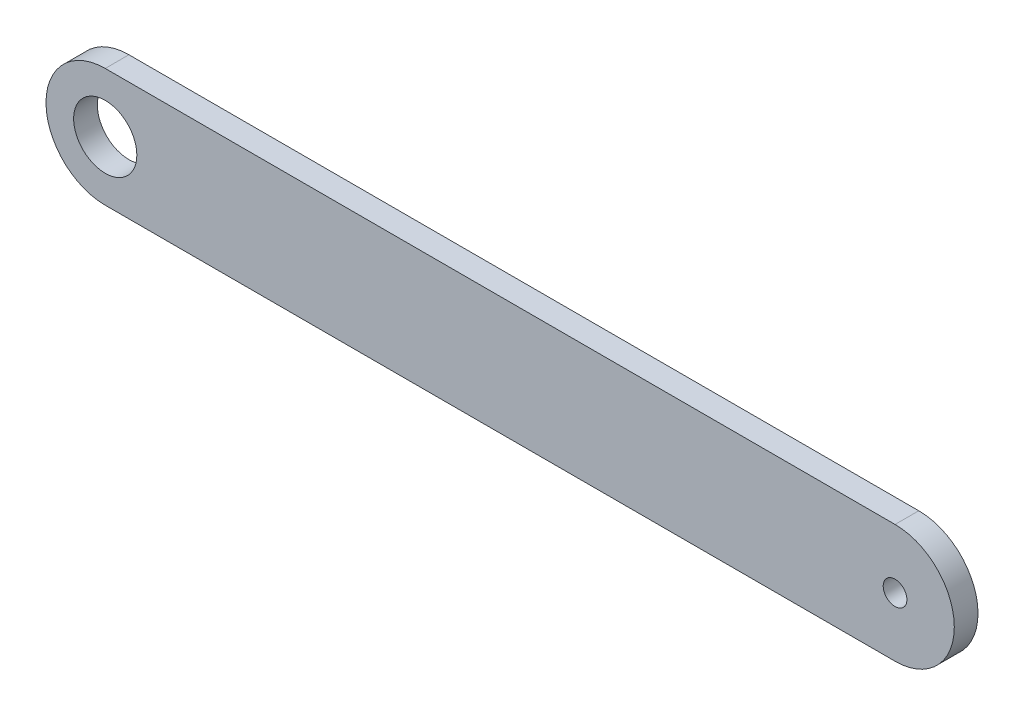
from build123d import *

# Parameters (mm, degrees)
BOSS_EXTRUDE1_DEPTH = 3
SKETCH2_R           = 4
SKETCH2_R_2         = 1.5
CUT_EXTRUDE1_DEPTH  = 10


with BuildPart() as part:
    # Sketch1 → Boss-Extrude1 (new body)
    with BuildSketch(Plane.XY):
        with BuildLine():
            Line((100, 7.5), (0, 7.5))
            ThreePointArc((0, 7.5), (-7.5, 0), (0, -7.5))
            Line((0, -7.5), (100, -7.5))
            ThreePointArc((100, -7.5), (107.5, 0), (100, 7.5))
        make_face()
    extrude(amount=BOSS_EXTRUDE1_DEPTH)

    # Sketch2 → Cut-Extrude1 (cut)
    with BuildSketch(Plane.XY.offset(3)):
        Circle(SKETCH2_R)
        with Locations((100, 0)):
            Circle(SKETCH2_R_2)
    extrude(amount=-CUT_EXTRUDE1_DEPTH, mode=Mode.SUBTRACT)


solid = part.part
